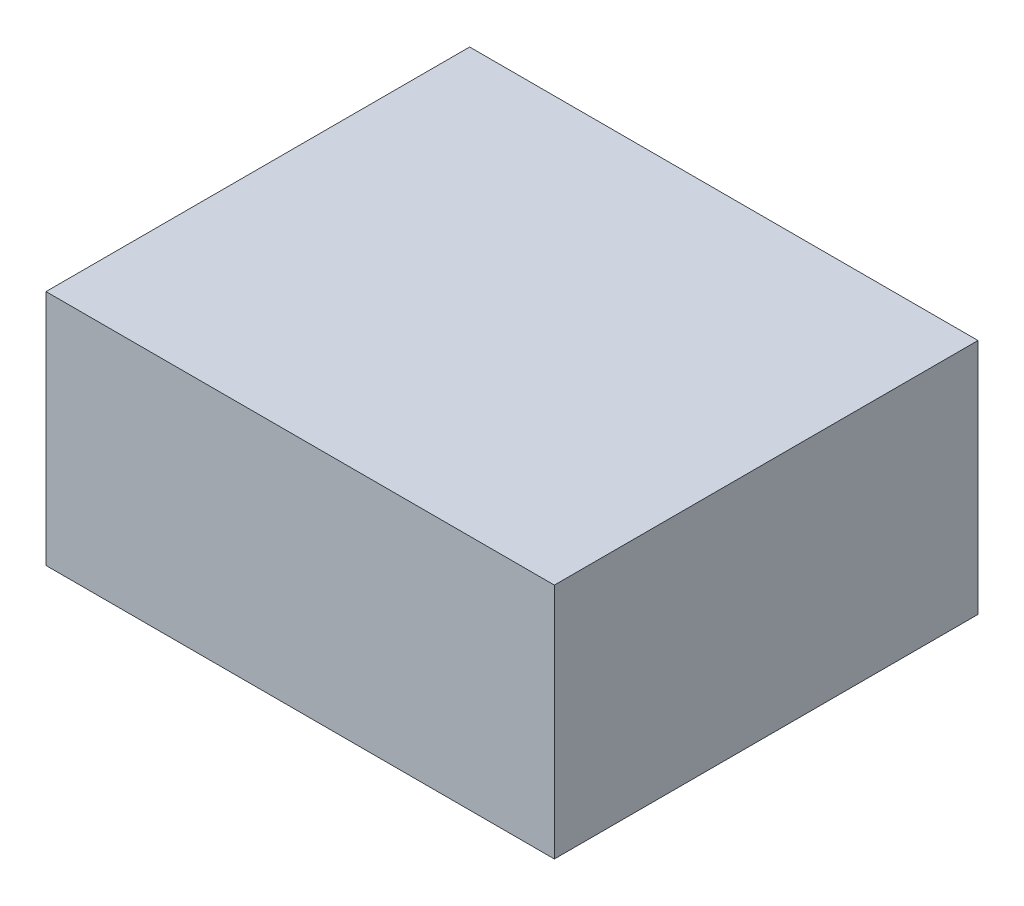
from build123d import *

# Parameters (mm, degrees)
SK_PACK_W    = 90
SK_PACK_H    = 42
PACK_2_DEPTH = 37.5


with BuildPart() as part:
    # SK_Pack → Pack 2 (new, symmetric)
    with BuildSketch(Plane.XY):
        with Locations((0, 21)):
            Rectangle(SK_PACK_W, SK_PACK_H)
    extrude(amount=PACK_2_DEPTH, both=True)


solid = part.part
